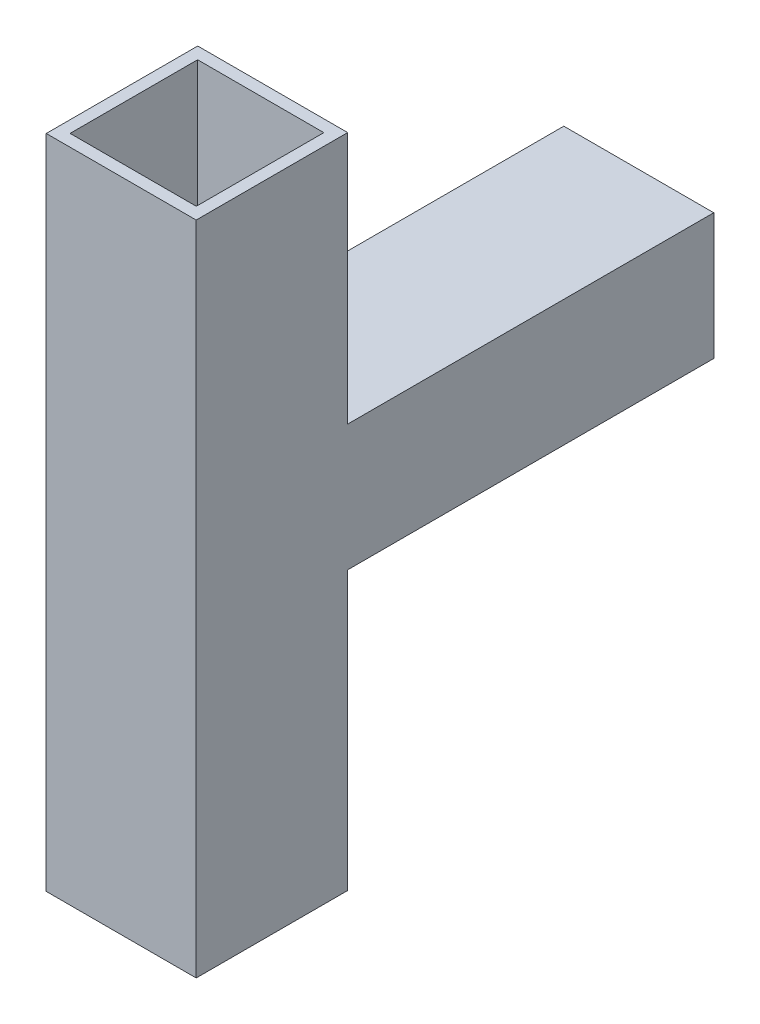
from build123d import *

# Parameters (mm, degrees)
SKETCH1_W           = 5.93875838
SKETCH1_H           = 6
SKETCH1_W_2         = 5
SKETCH1_H_2         = 5.051560964
BOSS_EXTRUDE1_DEPTH = 26
SKETCH4_W           = 5.93875838
SKETCH4_H           = 5
BOSS_EXTRUDE2_DEPTH = 14.5
SKETCH5_W           = 4
SKETCH5_H           = 4
CUT_EXTRUDE1_DEPTH  = 14.974219518


with BuildPart() as part:
    # Sketch1 → Boss-Extrude1 (new body)
    with BuildSketch(Plane(origin=(0, 0, 0), x_dir=(1, 0, 0), z_dir=(0, 1, 0))):
        Rectangle(SKETCH1_W, SKETCH1_H)
        Rectangle(SKETCH1_W_2, SKETCH1_H_2, mode=Mode.SUBTRACT)
    extrude(amount=BOSS_EXTRUDE1_DEPTH)

    # Sketch4 → Boss-Extrude2 (add)
    with BuildSketch(Plane(origin=(0, 0, -3), x_dir=(-1, 0, 0), z_dir=(0, 0, -1))):
        with Locations((0, 13.5)):
            Rectangle(SKETCH4_W, SKETCH4_H)
    extrude(amount=BOSS_EXTRUDE2_DEPTH)

    # Sketch5 → Cut-Extrude1 (cut)
    with BuildSketch(Plane(origin=(0, 0, -17.5), x_dir=(-1, 0, 0), z_dir=(0, 0, -1))):
        with Locations((0.03062081, 13.5)):
            Rectangle(SKETCH5_W, SKETCH5_H)
    extrude(amount=-CUT_EXTRUDE1_DEPTH, mode=Mode.SUBTRACT)


solid = part.part
